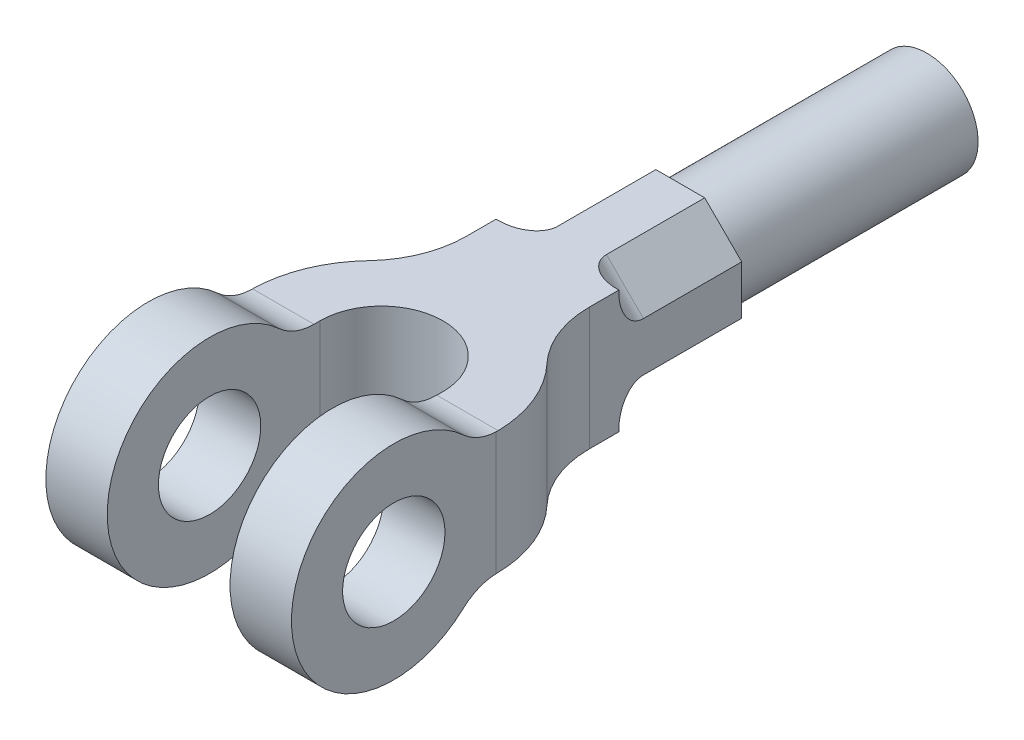
from build123d import *

# Parameters (mm, degrees)
SKETCH1_W           = 120
SKETCH1_H           = 250
BOSS_EXTRUDE1_DEPTH = 100
CUT_EXTRUDE2_DEPTH  = 171.953209973
SKETCH3_R           = 25
CUT_EXTRUDE5_DEPTH  = 201.062490237
CUT_EXTRUDE8_DEPTH  = 60
SKETCH6_R           = 25
BOSS_EXTRUDE2_DEPTH = 120.5
FILLET1_R           = 12


with BuildPart() as part:
    # Sketch1 → Boss-Extrude1 (new body)
    with BuildSketch(Plane(origin=(0, 0, 0), x_dir=(1, 0, 0), z_dir=(0, 1, 0))):
        Rectangle(SKETCH1_W, SKETCH1_H)
    extrude(amount=BOSS_EXTRUDE1_DEPTH)

    # Sketch2 → Cut-Extrude2 (cut, through all)
    with BuildSketch(Plane(origin=(0, 100, 0), x_dir=(1, 0, 0), z_dir=(0, 1, 0))):
        with BuildLine():
            Line((-30, 50.498344353), (-30, 124.968053811))
            Line((-30, 124.968053811), (30, 124.968053811))
            Line((30, 124.968053811), (30, 50.498344353))
            ThreePointArc((30, 50.498344353), (33.533981136, 32.034620706), (43.636363636, 16.180915101))
            ThreePointArc((43.636363636, 16.180915101), (55.759222691, -2.84353176), (60, -25.000000292))
            Line((60, -25.000000292), (60, 125))
            Line((60, 125), (-60, 125))
            Line((-60, 125), (-60, -25))
            ThreePointArc((-60, -25), (-55.759222637, -2.843531624), (-43.636363636, 16.180915101))
            ThreePointArc((-43.636363636, 16.180915101), (-33.533981136, 32.034620706), (-30, 50.498344353))
        make_face()
        with BuildLine():
            ThreePointArc((30, -21), (21.213203436, 0.213203436), (0, 9))
            ThreePointArc((0, 9), (-21.213203436, 0.213203436), (-30, -21))
            Line((-30, -21), (-30, -125))
            Line((-30, -125), (30, -125))
            Line((30, -125), (30, -21))
        make_face()
    extrude(amount=-CUT_EXTRUDE2_DEPTH, mode=Mode.SUBTRACT)

    # Sketch3 → Cut-Extrude5 (cut, through all)
    with BuildSketch(Plane(origin=(60, 0, 0), x_dir=(0, 0, -1), z_dir=(1, 0, 0))):
        with BuildLine():
            Line((-24.009804864, 80), (124.958839528, 80))
            Line((124.958839528, 80), (124.958839528, 20))
            Line((124.958839528, 20), (-24.009804864, 20))
            ThreePointArc((-24.009804864, 20), (-33.138514156, 18.273733406), (-41.006536576, 13.333333333))
            ThreePointArc((-41.006536576, 13.333333333), (-56.742581416, 3.452533187), (-75, 0))
            Line((-75, 0), (124.968053811, 0))
            Line((124.968053811, 0), (124.968053811, 100))
            Line((124.968053811, 100), (-75, 100))
            ThreePointArc((-75, 100), (-56.742581416, 96.547466813), (-41.006536576, 86.666666667))
            ThreePointArc((-41.006536576, 86.666666667), (-33.138514156, 81.726266594), (-24.009804864, 80))
        make_face()
        with BuildLine():
            ThreePointArc((-125, 50), (-110.355339059, 85.355339059), (-75, 100))
            Line((-75, 100), (-125, 100))
            Line((-125, 100), (-125, 50))
        make_face()
        with BuildLine():
            ThreePointArc((-75, 0), (-110.355339059, 14.644660941), (-125, 50))
            Line((-125, 50), (-125, 0))
            Line((-125, 0), (-75, 0))
        make_face()
        with Locations((-75, 50)):
            Circle(SKETCH3_R)
    extrude(amount=-CUT_EXTRUDE5_DEPTH, mode=Mode.SUBTRACT)

    # Sketch4 → Cut-Extrude8 (cut)
    with BuildSketch(Plane(origin=(0, 0, -124.958839528), x_dir=(-1, 0, 0), z_dir=(0, 0, -1))):
        Polygon((11.94, 80), (30, 61.94), (30, 80), align=None)
        Polygon((30, 38.06), (11.94, 20), (30, 20), align=None)
        Polygon((-11.94, 20), (-30, 38.06), (-30, 20), align=None)
        Polygon((-30, 61.94), (-11.94, 80), (-30, 80), align=None)
    extrude(amount=-CUT_EXTRUDE8_DEPTH, mode=Mode.SUBTRACT)

    # Sketch6 → Boss-Extrude2 (add)
    with BuildSketch(Plane(origin=(0, 0, -124.958839528), x_dir=(-1, 0, 0), z_dir=(0, 0, -1))):
        with Locations((0, 50)):
            Circle(SKETCH6_R)
    extrude(amount=BOSS_EXTRUDE2_DEPTH)

    # Fillet1
    fillet1_edges = [part.edges().sort_by_distance(p)[0] for p in [
        (-20.97, 29.03, -64.958839528),
        (-20.97, 70.97, -64.958839528),
        (20.97, 29.03, -64.958839528),
        (20.97, 70.97, -64.958839528),
    ]]
    fillet(fillet1_edges, radius=FILLET1_R)


solid = part.part
